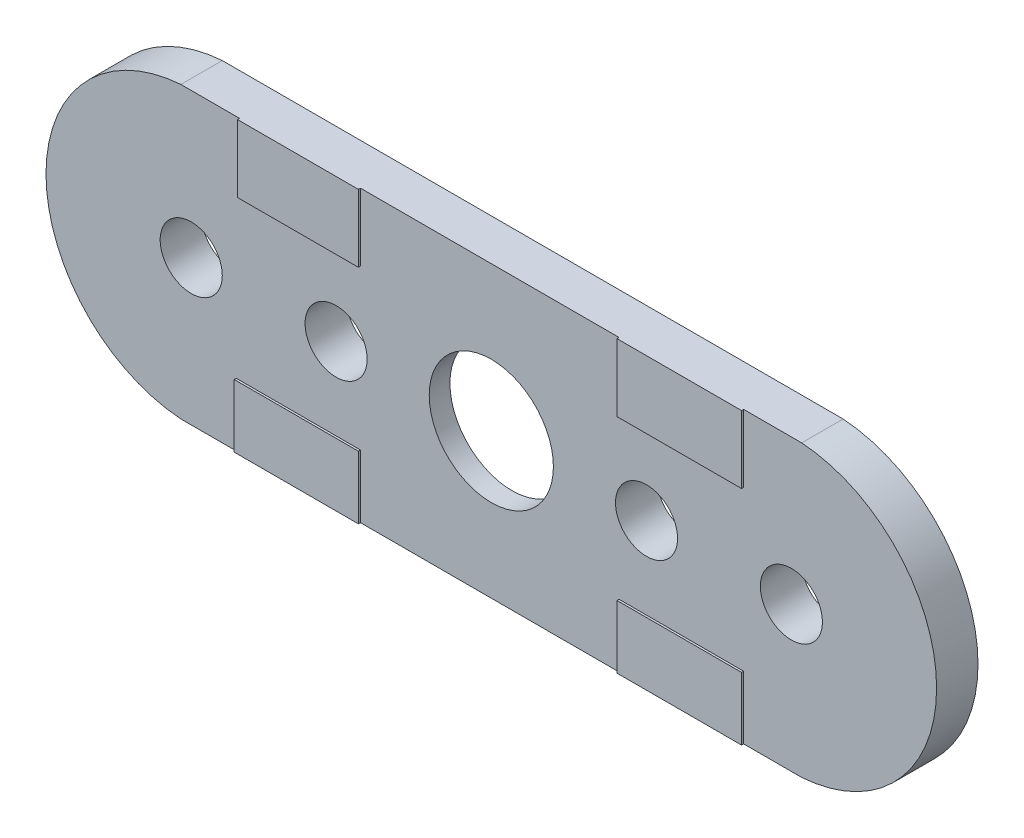
from build123d import *

# Parameters (mm, degrees)
SKETCH1_R           = 3
SKETCH1_R_2         = 1.5
BOSS_EXTRUDE1_DEPTH = 2
SKETCH2_W           = 6.020555891
SKETCH2_H           = 3.042269969
SKETCH2_H_2         = 3.263297615
SKETCH2_W_2         = 6
SKETCH2_W_3         = 5.83801195
BOSS_EXTRUDE2_DEPTH = 0.1
SKETCH3_R           = 5
CUT_EXTRUDE1_DEPTH  = 1


with BuildPart() as part:
    # Sketch1 → Boss-Extrude1 (new body)
    with BuildSketch(Plane.XY):
        with BuildLine():
            Line((-15, -7), (15, -7))
            ThreePointArc((15, -7), (21.517834424, 0), (15, 7))
            Line((15, 7), (-15, 7))
            ThreePointArc((-15, 7), (-21.517834424, 0), (-15, -7))
        make_face()
        Circle(SKETCH1_R, mode=Mode.SUBTRACT)
        with Locations((-14.5, 0)):
            Circle(SKETCH1_R_2, mode=Mode.SUBTRACT)
        with Locations((14.5, 0)):
            Circle(SKETCH1_R_2, mode=Mode.SUBTRACT)
        with Locations((-7.5, 0)):
            Circle(SKETCH1_R_2, mode=Mode.SUBTRACT)
        with Locations((7.5, 0)):
            Circle(SKETCH1_R_2, mode=Mode.SUBTRACT)
    extrude(amount=BOSS_EXTRUDE1_DEPTH)

    # Sketch2 → Boss-Extrude2 (add)
    with BuildSketch(Plane.XY.offset(2)):
        with Locations((9.181574615, -5.478865016)):
            Rectangle(SKETCH2_W, SKETCH2_H)
        with Locations((9.181574615, 5.368351193)):
            Rectangle(SKETCH2_W, SKETCH2_H_2)
        with Locations((-9.322339138, -5.478865016)):
            Rectangle(SKETCH2_W_2, SKETCH2_H)
        with Locations((-9.241345113, 5.368351193)):
            Rectangle(SKETCH2_W_3, SKETCH2_H_2)
    extrude(amount=BOSS_EXTRUDE2_DEPTH)

    # Sketch3 → Cut-Extrude1 (cut)
    with BuildSketch(Plane(origin=(0, 0, 0), x_dir=(-1, 0, 0), z_dir=(0, 0, -1))):
        Circle(SKETCH3_R)
    extrude(amount=-CUT_EXTRUDE1_DEPTH, mode=Mode.SUBTRACT)


solid = part.part
